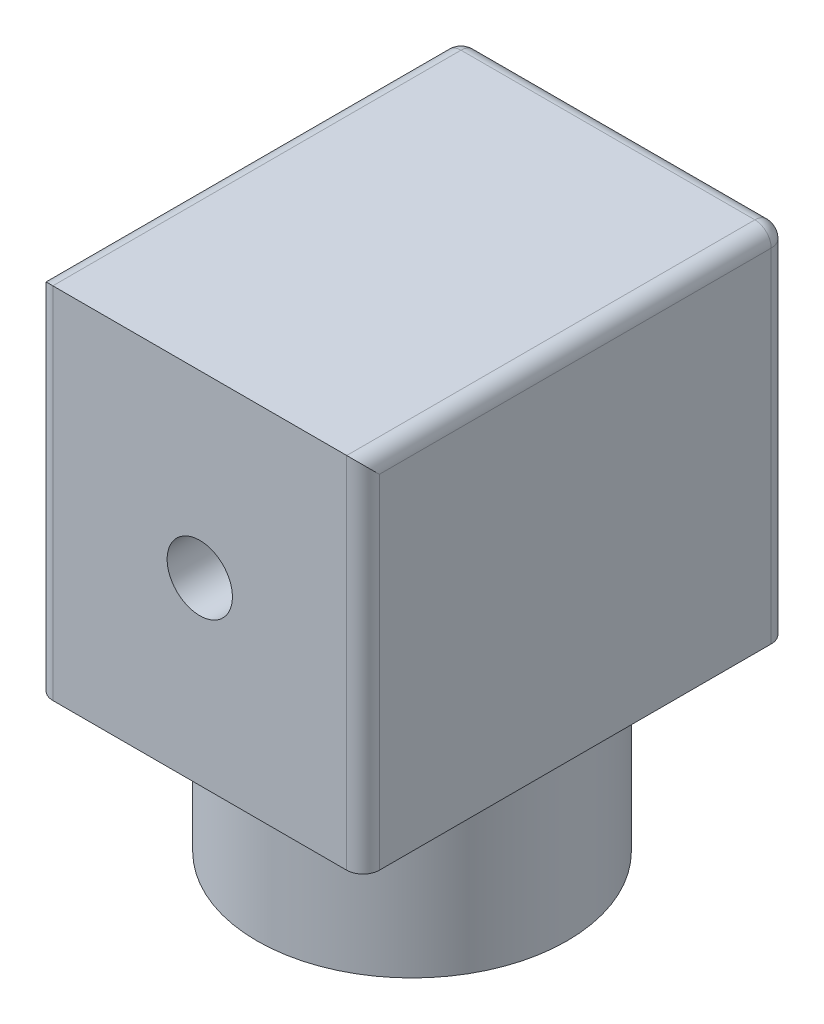
from build123d import *

# Parameters (mm, degrees)
SKETCH1_W           = 100
SKETCH1_H           = 110
BOSS_EXTRUDE1_DEPTH = 130
SKETCH2_R           = 47.5
BOSS_EXTRUDE2_DEPTH = 50
SKETCH4_R           = 10
CUT_EXTRUDE3_DEPTH  = 20
SKETCH5_R           = 10
CUT_EXTRUDE4_DEPTH  = 20
FILLET1_R           = 5


with BuildPart() as part:
    # Sketch1 → Boss-Extrude1 (new body)
    with BuildSketch(Plane.XY):
        Rectangle(SKETCH1_W, SKETCH1_H)
    extrude(amount=BOSS_EXTRUDE1_DEPTH)

    # Sketch2 → Boss-Extrude2 (add)
    with BuildSketch(Plane(origin=(0, -55, 0), x_dir=(1, 0, 0), z_dir=(0, 1, 0))):
        with Locations(Location((0, -65, 0), (0, 0, 180))):
            Circle(SKETCH2_R)
    extrude(amount=-BOSS_EXTRUDE2_DEPTH)

    # Sketch4 → Cut-Extrude3 (cut)
    with BuildSketch(Plane.XZ.offset(105)):
        with Locations(Location((0, 65, 0), (0, 0, 270))):
            Circle(SKETCH4_R)
    extrude(amount=-CUT_EXTRUDE3_DEPTH, mode=Mode.SUBTRACT)

    # Sketch5 → Cut-Extrude4 (cut)
    with BuildSketch(Plane.XY.offset(130)):
        Circle(SKETCH5_R)
    extrude(amount=-CUT_EXTRUDE4_DEPTH, mode=Mode.SUBTRACT)

    # Fillet1
    fillet1_edges = [part.edges().sort_by_distance(p)[0] for p in [
        (50, 0, 130),
        (-50, 0, 130),
        (0, 55, 0),
        (50, 0, 0),
        (-50, 0, 0),
        (-50, 55, 65),
        (50, 55, 65),
    ]]
    fillet(fillet1_edges, radius=FILLET1_R)


solid = part.part
